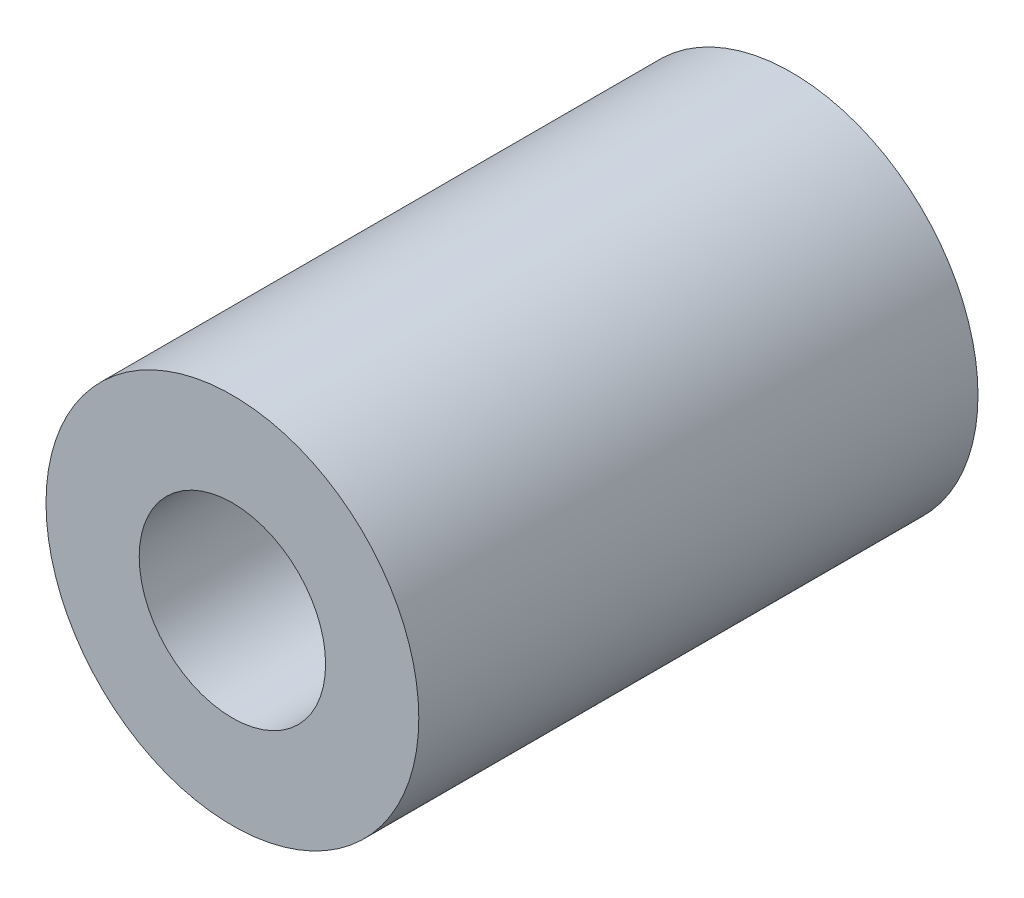
from build123d import *

# Parameters (mm, degrees)
SKETCH1_R           = 10
BOSS_EXTRUDE1_DEPTH = 30
SKETCH2_R           = 5
CUT_EXTRUDE1_DEPTH  = 50


with BuildPart() as part:
    # Sketch1 → Boss-Extrude1 (new body)
    with BuildSketch(Plane.XY):
        Circle(SKETCH1_R)
    extrude(amount=BOSS_EXTRUDE1_DEPTH)

    # Sketch2 → Cut-Extrude1 (cut)
    with BuildSketch(Plane(origin=(0, 0, 0), x_dir=(-1, 0, 0), z_dir=(0, 0, -1))):
        Circle(SKETCH2_R)
    extrude(amount=-CUT_EXTRUDE1_DEPTH, mode=Mode.SUBTRACT)


solid = part.part
